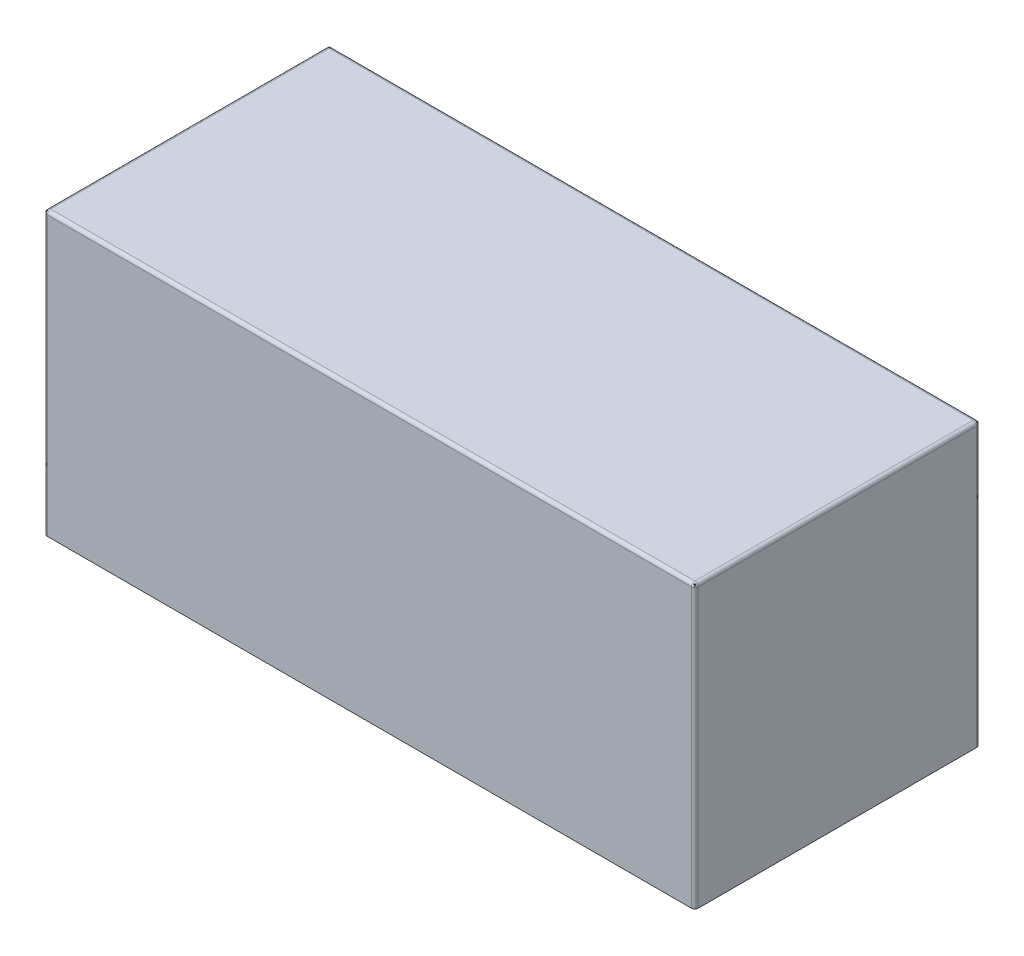
from build123d import *

# Parameters (mm, degrees)
SKETCH2_W           = 970
SKETCH2_H           = 425
SKETCH2_W_2         = 966.825
SKETCH2_H_2         = 421.825
BOSS_EXTRUDE1_DEPTH = 420
BOSS_EXTRUDE2_START = 420
SKETCH3_W           = 970
SKETCH3_H           = 425
BOSS_EXTRUDE2_DEPTH = 1.5875
FILLET2_R           = 5


with BuildPart() as part:
    # Sketch2 → Boss-Extrude1 (new body)
    with BuildSketch(Plane(origin=(0, 0, 0), x_dir=(1, 0, 0), z_dir=(0, 1, 0))):
        Rectangle(SKETCH2_W, SKETCH2_H)
        Rectangle(SKETCH2_W_2, SKETCH2_H_2, mode=Mode.SUBTRACT)
    extrude(amount=BOSS_EXTRUDE1_DEPTH)

    # Sketch3 → Boss-Extrude2 (add)
    with BuildSketch(Plane(origin=(0, 0, 0), x_dir=(1, 0, 0), z_dir=(0, 1, 0)).offset(BOSS_EXTRUDE2_START)):
        Rectangle(SKETCH3_W, SKETCH3_H)
    extrude(amount=-BOSS_EXTRUDE2_DEPTH)

    # Fillet2
    fillet2_edges = [part.edges().sort_by_distance(p)[0] for p in [
        (-485, 420, 0),
        (0, 420, 212.5),
        (485, 420, 0),
        (485, 210, 212.5),
        (-485, 210, 212.5),
        (-485, 210, -212.5),
        (485, 210, -212.5),
        (0, 420, -212.5),
    ]]
    fillet(fillet2_edges, radius=FILLET2_R)


solid = part.part
